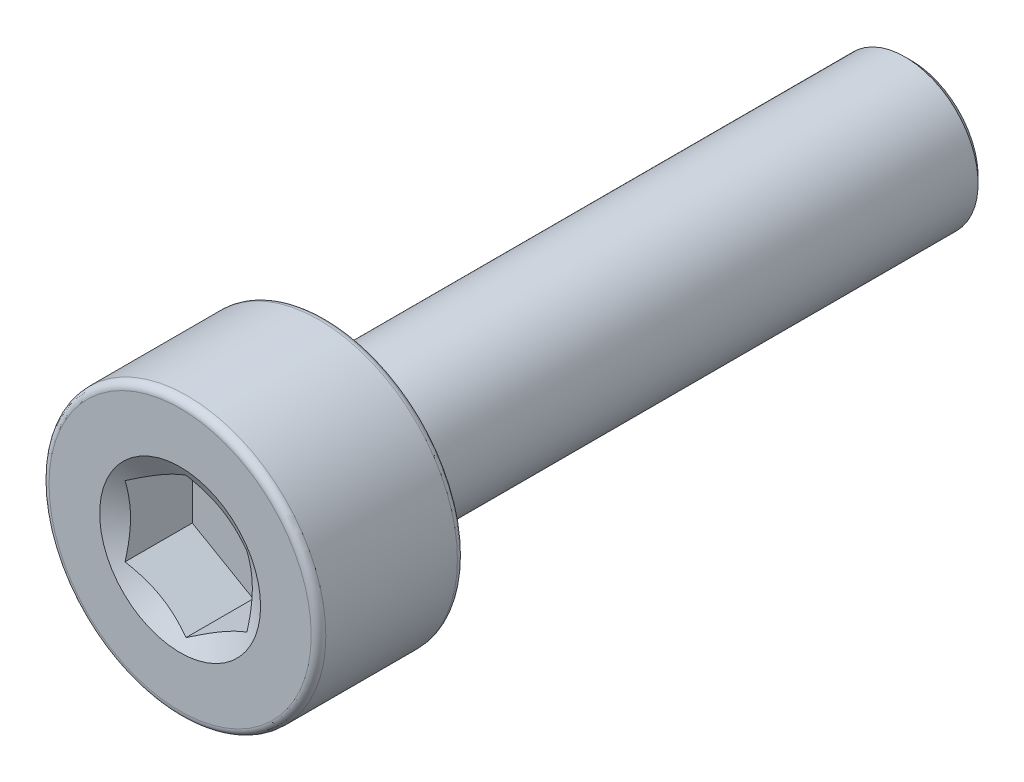
from build123d import *

# Parameters (mm, degrees)
CUT_EXTRUDE1_START = 7.5
CUT_EXTRUDE1_DEPTH = 1.5


with BuildPart() as part:
    # Sketch2 → Revolve1 (revolve)
    with BuildSketch(Plane(origin=(0, 0, 0), x_dir=(0, 0, -1), z_dir=(1, 0, 0)), mode=Mode.PRIVATE) as revolve1_sk:
        with BuildLine():
            Line((7.5, 0), (7.5, 1.375))
            Line((7.5, 1.375), (7.375, 1.5))
            Line((7.375, 1.5), (-4.5, 1.5))
            Line((-4.5, 1.5), (-4.5, 2.69))
            ThreePointArc((-4.5, 2.69), (-4.543933983, 2.796066017), (-4.65, 2.84))
            Line((-4.65, 2.84), (-7.35, 2.84))
            ThreePointArc((-7.35, 2.84), (-7.456066017, 2.796066017), (-7.5, 2.69))
            Line((-7.5, 2.69), (-7.5, 0))
            Line((-7.5, 0), (7.5, 0))
        make_face()
    revolve(revolve1_sk.sketch.rotate(Axis((0, 0, -7.5), (0, 0, 1)), 90), axis=Axis((0, 0, -7.5), (0, 0, 1)))

    # Sketch3 → Cut-Extrude1 (cut)
    with BuildSketch(Plane.XY.offset(CUT_EXTRUDE1_START)):
        Polygon((-1.25, 0.721687836), (-1.25, -0.721687836), (0, -1.443375673), (1.25, -0.721687836), (1.25, 0.721687836), (0, 1.443375673), align=None)
    extrude(amount=-CUT_EXTRUDE1_DEPTH, mode=Mode.SUBTRACT)

    # Cut-Extrude2 cone 1 section (through the dimple's axis) → Cut-Extrude2 (revolve, cut)
    with BuildSketch(Plane(origin=(0, 0, 7.5), x_dir=(0, -1, 0), z_dir=(1, 0, 0))):
        Polygon((0, 0), (1.651146394, 0), (0, 0.953289815), align=None)
    revolve(axis=Axis((0, 0, 7.5), (0, 0, -1)), mode=Mode.SUBTRACT)


solid = part.part
